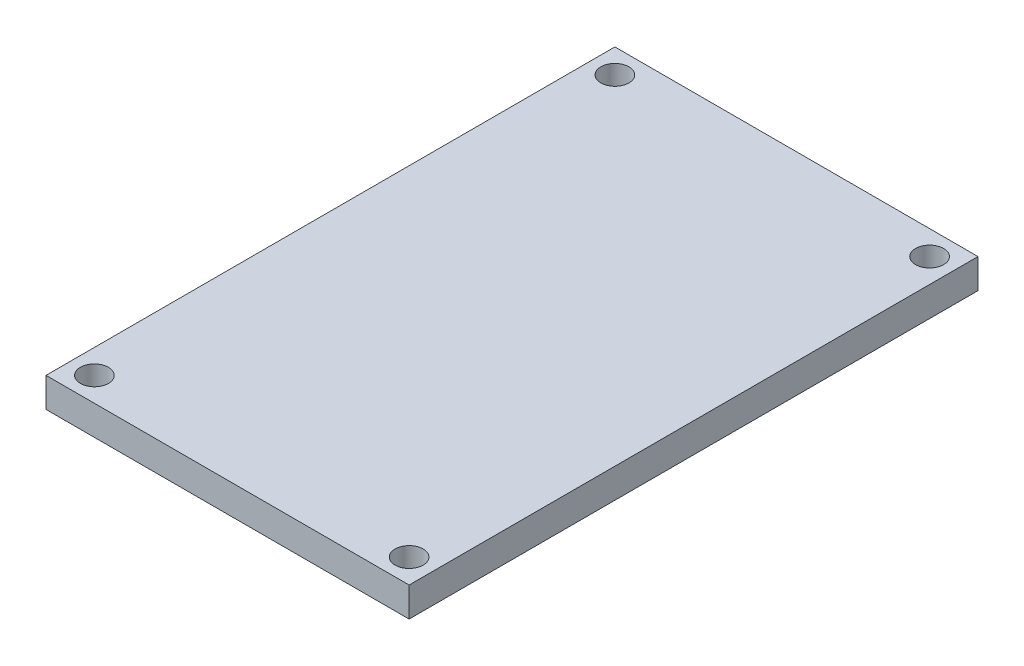
from build123d import *

# Parameters (mm, degrees)
SKETCH1_W           = 38.1
SKETCH1_H           = 59.69
SKETCH1_R           = 1.4732
BOSS_EXTRUDE1_DEPTH = 3.0988


with BuildPart() as part:
    # Sketch1 → Boss-Extrude1 (new body)
    with BuildSketch(Plane(origin=(0, 0, 0), x_dir=(1, 0, 0), z_dir=(0, 1, 0))):
        Rectangle(SKETCH1_W, SKETCH1_H)
        with Locations(Location((-16.51, 27.305, 0), (0, 0, 270))):
            Circle(SKETCH1_R, mode=Mode.SUBTRACT)
        with Locations(Location((16.51, 27.305, 0), (0, 0, 90))):
            Circle(SKETCH1_R, mode=Mode.SUBTRACT)
        with Locations(Location((-16.51, -27.305, 0), (0, 0, 90))):
            Circle(SKETCH1_R, mode=Mode.SUBTRACT)
        with Locations(Location((16.51, -27.305, 0), (0, 0, 270))):
            Circle(SKETCH1_R, mode=Mode.SUBTRACT)
    extrude(amount=BOSS_EXTRUDE1_DEPTH)


solid = part.part
